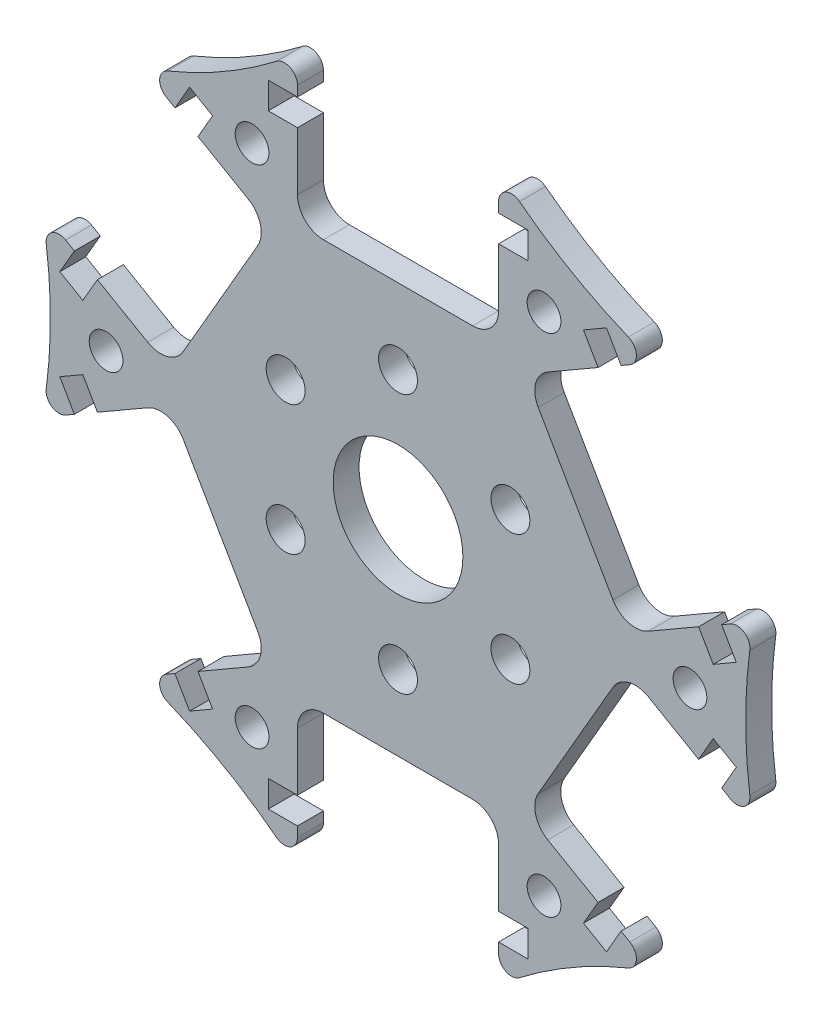
from build123d import *

# Parameters (mm, degrees)
SKETCH_1_R          = 28.3
EXTRUDE_1_DEPTH     = 2
SKETCH_2_R          = 5
SKETCH_2_R_2        = 1.5
SKETCH_2_R_3        = 1.3
CUT_EXTRUDE_1_DEPTH = 41.072184867
CUT_EXTRUDE_3_DEPTH = 40.315613947
FILLET_2_R          = 2
FILLET_1_R          = 1


with BuildPart() as part:
    # ｽｹｯﾁ1 → ﾎﾞｽ - 押し出し1 (new body)
    with BuildSketch(Plane.XY):
        Circle(SKETCH_1_R)
    extrude(amount=EXTRUDE_1_DEPTH)

    # ｽｹｯﾁ2 → ｶｯﾄ - 押し出し1 (cut, through all)
    with BuildSketch(Plane.XY.offset(2)):
        Circle(SKETCH_2_R)
        with Locations((8.660254038, 5)):
            Circle(SKETCH_2_R_2)
        with Locations((8.660254038, -5)):
            Circle(SKETCH_2_R_2)
        with Locations((0, -10)):
            Circle(SKETCH_2_R_2)
        with Locations((-8.660254038, -5)):
            Circle(SKETCH_2_R_2)
        with Locations((-8.660254038, 5)):
            Circle(SKETCH_2_R_2)
        with Locations((0, 10)):
            Circle(SKETCH_2_R_2)
        with Locations((11.25, 19.485571585)):
            Circle(SKETCH_2_R_3)
        with Locations((22.5, 0)):
            Circle(SKETCH_2_R_3)
        with Locations((11.25, -19.485571585)):
            Circle(SKETCH_2_R_3)
        with Locations((-11.25, -19.485571585)):
            Circle(SKETCH_2_R_3)
        with Locations((-22.5, 0)):
            Circle(SKETCH_2_R_3)
        with Locations((-11.25, 19.485571585)):
            Circle(SKETCH_2_R_3)
        with BuildLine():
            Line((7.75, 24.325), (10, 24.325))
            Line((10, 24.325), (10, 22.275))
            Line((10, 22.275), (7.75, 22.275))
            Line((7.75, 22.275), (7.75, 15.8))
            Line((7.75, 15.8), (-7.75, 15.8))
            Line((-7.75, 15.8), (-7.75, 22.275))
            Line((-7.75, 22.275), (-10, 22.275))
            Line((-10, 22.275), (-10, 24.325))
            Line((-10, 24.325), (-7.75, 24.325))
            Line((-7.75, 24.325), (-7.75, 27.21814652))
            ThreePointArc((-7.75, 27.21814652), (0, 28.3), (7.75, 27.21814652))
            Line((7.75, 27.21814652), (7.75, 24.325))
        make_face()
        with BuildLine():
            Line((24.941067947, 5.450803121), (26.066067947, 3.502245962))
            Line((26.066067947, 3.502245962), (24.290715869, 2.477245962))
            Line((24.290715869, 2.477245962), (23.165715869, 4.425803121))
            Line((23.165715869, 4.425803121), (17.55820138, 1.188303121))
            Line((17.55820138, 1.188303121), (9.80820138, 14.611696879))
            Line((9.80820138, 14.611696879), (15.415715869, 17.849196879))
            Line((15.415715869, 17.849196879), (14.290715869, 19.797754038))
            Line((14.290715869, 19.797754038), (16.066067947, 20.822754038))
            Line((16.066067947, 20.822754038), (17.191067947, 18.874196879))
            Line((17.191067947, 18.874196879), (19.69660633, 20.320770139))
            ThreePointArc((19.69660633, 20.320770139), (24.508518927, 14.15), (27.44660633, 6.897376381))
            Line((27.44660633, 6.897376381), (24.941067947, 5.450803121))
        make_face()
        with BuildLine():
            Line((17.191067947, -18.874196879), (16.066067947, -20.822754038))
            Line((16.066067947, -20.822754038), (14.290715869, -19.797754038))
            Line((14.290715869, -19.797754038), (15.415715869, -17.849196879))
            Line((15.415715869, -17.849196879), (9.80820138, -14.611696879))
            Line((9.80820138, -14.611696879), (17.55820138, -1.188303121))
            Line((17.55820138, -1.188303121), (23.165715869, -4.425803121))
            Line((23.165715869, -4.425803121), (24.290715869, -2.477245962))
            Line((24.290715869, -2.477245962), (26.066067947, -3.502245962))
            Line((26.066067947, -3.502245962), (24.941067947, -5.450803121))
            Line((24.941067947, -5.450803121), (27.44660633, -6.897376381))
            ThreePointArc((27.44660633, -6.897376381), (24.508518927, -14.15), (19.69660633, -20.320770139))
            Line((19.69660633, -20.320770139), (17.191067947, -18.874196879))
        make_face()
        with BuildLine():
            Line((-7.75, -24.325), (-10, -24.325))
            Line((-10, -24.325), (-10, -22.275))
            Line((-10, -22.275), (-7.75, -22.275))
            Line((-7.75, -22.275), (-7.75, -15.8))
            Line((-7.75, -15.8), (7.75, -15.8))
            Line((7.75, -15.8), (7.75, -22.275))
            Line((7.75, -22.275), (10, -22.275))
            Line((10, -22.275), (10, -24.325))
            Line((10, -24.325), (7.75, -24.325))
            Line((7.75, -24.325), (7.75, -27.21814652))
            ThreePointArc((7.75, -27.21814652), (0, -28.3), (-7.75, -27.21814652))
            Line((-7.75, -27.21814652), (-7.75, -24.325))
        make_face()
        with BuildLine():
            Line((-24.941067947, -5.450803121), (-26.066067947, -3.502245962))
            Line((-26.066067947, -3.502245962), (-24.290715869, -2.477245962))
            Line((-24.290715869, -2.477245962), (-23.165715869, -4.425803121))
            Line((-23.165715869, -4.425803121), (-17.55820138, -1.188303121))
            Line((-17.55820138, -1.188303121), (-9.80820138, -14.611696879))
            Line((-9.80820138, -14.611696879), (-15.415715869, -17.849196879))
            Line((-15.415715869, -17.849196879), (-14.290715869, -19.797754038))
            Line((-14.290715869, -19.797754038), (-16.066067947, -20.822754038))
            Line((-16.066067947, -20.822754038), (-17.191067947, -18.874196879))
            Line((-17.191067947, -18.874196879), (-19.69660633, -20.320770139))
            ThreePointArc((-19.69660633, -20.320770139), (-24.508518927, -14.15), (-27.44660633, -6.897376381))
            Line((-27.44660633, -6.897376381), (-24.941067947, -5.450803121))
        make_face()
        with BuildLine():
            Line((-17.191067947, 18.874196879), (-16.066067947, 20.822754038))
            Line((-16.066067947, 20.822754038), (-14.290715869, 19.797754038))
            Line((-14.290715869, 19.797754038), (-15.415715869, 17.849196879))
            Line((-15.415715869, 17.849196879), (-9.80820138, 14.611696879))
            Line((-9.80820138, 14.611696879), (-17.55820138, 1.188303121))
            Line((-17.55820138, 1.188303121), (-23.165715869, 4.425803121))
            Line((-23.165715869, 4.425803121), (-24.290715869, 2.477245962))
            Line((-24.290715869, 2.477245962), (-26.066067947, 3.502245962))
            Line((-26.066067947, 3.502245962), (-24.941067947, 5.450803121))
            Line((-24.941067947, 5.450803121), (-27.44660633, 6.897376381))
            ThreePointArc((-27.44660633, 6.897376381), (-24.508518927, 14.15), (-19.69660633, 20.320770139))
            Line((-19.69660633, 20.320770139), (-17.191067947, 18.874196879))
        make_face()
    extrude(amount=-CUT_EXTRUDE_1_DEPTH, mode=Mode.SUBTRACT)

    # ｽｹｯﾁ3 → ｶｯﾄ - 押し出し3 (cut, through all)
    with BuildSketch(Plane.XY.offset(2)):
        with BuildLine():
            ThreePointArc((7.75, 27.21814652), (13.394592318, 23.200114441), (19.69660633, 20.320770139))
            ThreePointArc((19.69660633, 20.320770139), (14.15, 24.508518927), (7.75, 27.21814652))
        make_face()
        with BuildLine():
            ThreePointArc((27.44660633, 6.897376381), (26.789184636, 0), (27.44660633, -6.897376381))
            ThreePointArc((27.44660633, -6.897376381), (28.3, 0), (27.44660633, 6.897376381))
        make_face()
        with BuildLine():
            ThreePointArc((19.69660633, -20.320770139), (13.394592318, -23.200114441), (7.75, -27.21814652))
            ThreePointArc((7.75, -27.21814652), (14.15, -24.508518927), (19.69660633, -20.320770139))
        make_face()
        with BuildLine():
            ThreePointArc((-7.75, -27.21814652), (-13.394592318, -23.200114441), (-19.69660633, -20.320770139))
            ThreePointArc((-19.69660633, -20.320770139), (-14.15, -24.508518927), (-7.75, -27.21814652))
        make_face()
        with BuildLine():
            ThreePointArc((-27.44660633, -6.897376381), (-26.789184636, 0), (-27.44660633, 6.897376381))
            ThreePointArc((-27.44660633, 6.897376381), (-28.3, 0), (-27.44660633, -6.897376381))
        make_face()
        with BuildLine():
            ThreePointArc((-19.69660633, 20.320770139), (-13.394592318, 23.200114441), (-7.75, 27.21814652))
            ThreePointArc((-7.75, 27.21814652), (-14.15, 24.508518927), (-19.69660633, 20.320770139))
        make_face()
    extrude(amount=-CUT_EXTRUDE_3_DEPTH, mode=Mode.SUBTRACT)

    # ﾌｨﾚｯﾄ2
    fillet_2_edges = [part.edges().sort_by_distance(p)[0] for p in [
        (9.80820138, -14.611696879, 1),
        (17.55820138, -1.188303121, 1),
        (17.55820138, 1.188303121, 1),
        (9.80820138, 14.611696879, 1),
        (7.75, 15.8, 1),
        (-7.75, 15.8, 1),
        (-9.80820138, 14.611696879, 1),
        (-17.55820138, 1.188303121, 1),
        (-7.75, -15.8, 1),
        (7.75, -15.8, 1),
        (-17.55820138, -1.188303121, 1),
        (-9.80820138, -14.611696879, 1),
    ]]
    fillet(fillet_2_edges, radius=FILLET_2_R)

    # ﾌｨﾚｯﾄ1
    fillet_1_edges = [part.edges().sort_by_distance(p)[0] for p in [
        (27.44660633, -6.897376381, 1),
        (19.69660633, -20.320770139, 1),
        (19.69660633, 20.320770139, 1),
        (27.44660633, 6.897376381, 1),
        (-7.75, 27.21814652, 1),
        (7.75, 27.21814652, 1),
        (-27.44660633, 6.897376381, 1),
        (-19.69660633, 20.320770139, 1),
        (7.75, -27.21814652, 1),
        (-7.75, -27.21814652, 1),
        (-19.69660633, -20.320770139, 1),
        (-27.44660633, -6.897376381, 1),
    ]]
    fillet(fillet_1_edges, radius=FILLET_1_R)


solid = part.part
